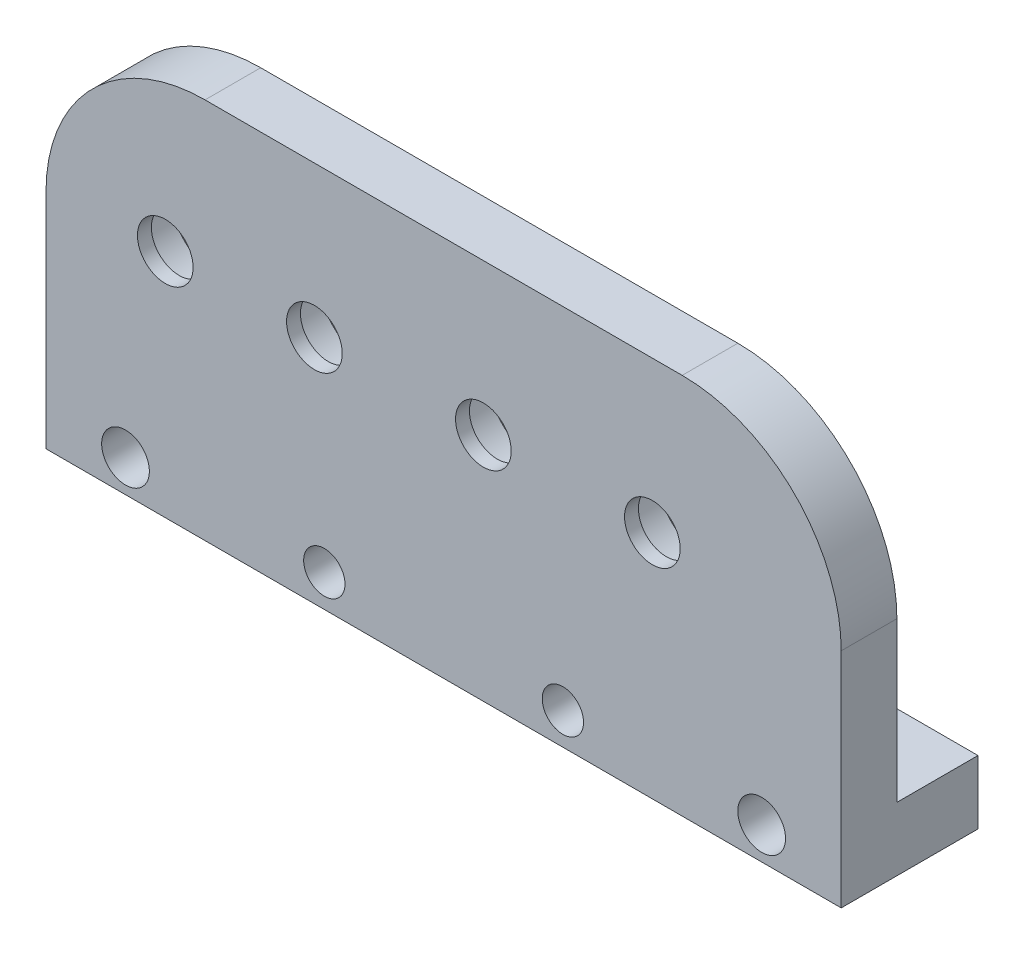
from build123d import *

# Parameters (mm, degrees)
SKETCH1_W           = 100
SKETCH1_H           = 48
BOSS_EXTRUDE1_DEPTH = 7
CUT_EXTRUDE1_REACH  = 113.144
SKETCH2_R           = 3.5
SKETCH3_W           = 100
SKETCH3_H           = 8
BOSS_EXTRUDE2_DEPTH = 10.2
SKETCH4_R           = 6.55
CUT_EXTRUDE2_DEPTH  = 5.25
SKETCH5_R           = 2.6
CUT_EXTRUDE3_DEPTH  = 7
SKETCH7_R           = 1.7
CUT_EXTRUDE4_DEPTH  = 112.391382072
CUT_EXTRUDE5_REACH  = 114.249
SKETCH8_R           = 1.7
SKETCH9_R           = 3
CUT_EXTRUDE6_DEPTH  = 10
FILLET1_R           = 20


with BuildPart() as part:
    # Sketch1 → Boss-Extrude1 (new body)
    with BuildSketch(Plane.XY):
        with Locations((50, 24)):
            Rectangle(SKETCH1_W, SKETCH1_H)
    extrude(amount=BOSS_EXTRUDE1_DEPTH)

    # Sketch2 → Cut-Extrude1 (cut, up to next)
    with BuildSketch(Plane.XY.offset(7), mode=Mode.PRIVATE) as cut_extrude1_sk1:
        with Locations((15, 29)):
            Circle(SKETCH2_R)
    cut_extrude1_tool1 = extrude(cut_extrude1_sk1.sketch, amount=-CUT_EXTRUDE1_REACH, mode=Mode.PRIVATE) & part.part
    # Sketch2 → Cut-Extrude1 (cut, up to next)
    with BuildSketch(Plane.XY.offset(7), mode=Mode.PRIVATE) as cut_extrude1_sk2:
        with Locations((33.75, 29)):
            Circle(SKETCH2_R)
    cut_extrude1_tool2 = extrude(cut_extrude1_sk2.sketch, amount=-CUT_EXTRUDE1_REACH, mode=Mode.PRIVATE) & part.part
    # Sketch2 → Cut-Extrude1 (cut, up to next)
    with BuildSketch(Plane.XY.offset(7), mode=Mode.PRIVATE) as cut_extrude1_sk3:
        with Locations((55, 29)):
            Circle(SKETCH2_R)
    cut_extrude1_tool3 = extrude(cut_extrude1_sk3.sketch, amount=-CUT_EXTRUDE1_REACH, mode=Mode.PRIVATE) & part.part
    # Sketch2 → Cut-Extrude1 (cut, up to next)
    with BuildSketch(Plane.XY.offset(7), mode=Mode.PRIVATE) as cut_extrude1_sk4:
        with Locations((76.25, 29)):
            Circle(SKETCH2_R)
    cut_extrude1_tool4 = extrude(cut_extrude1_sk4.sketch, amount=-CUT_EXTRUDE1_REACH, mode=Mode.PRIVATE) & part.part
    add(cut_extrude1_tool1.solids().sort_by_distance((15, 29, 7))[0], mode=Mode.SUBTRACT)
    add(cut_extrude1_tool2.solids().sort_by_distance((33.75, 29, 7))[0], mode=Mode.SUBTRACT)
    add(cut_extrude1_tool3.solids().sort_by_distance((55, 29, 7))[0], mode=Mode.SUBTRACT)
    add(cut_extrude1_tool4.solids().sort_by_distance((76.25, 29, 7))[0], mode=Mode.SUBTRACT)

    # Sketch3 → Boss-Extrude2 (add)
    with BuildSketch(Plane(origin=(0, 0, 0), x_dir=(-1, 0, 0), z_dir=(0, 0, -1))):
        with Locations((-50, 4)):
            Rectangle(SKETCH3_W, SKETCH3_H)
    extrude(amount=BOSS_EXTRUDE2_DEPTH)

    # Sketch4 → Cut-Extrude2 (cut)
    with BuildSketch(Plane(origin=(0, 0, 0), x_dir=(-1, 0, 0), z_dir=(0, 0, -1))):
        with Locations((-76.25, 29)):
            Circle(SKETCH4_R)
        with Locations((-55, 29)):
            Circle(SKETCH4_R)
        with Locations((-33.75, 29)):
            Circle(SKETCH4_R)
        with Locations((-15, 29)):
            Circle(SKETCH4_R)
    extrude(amount=-CUT_EXTRUDE2_DEPTH, mode=Mode.SUBTRACT)

    # Sketch5 → Cut-Extrude3 (cut)
    with BuildSketch(Plane.XY.offset(7)):
        with Locations((35.000022648, 4.052132501)):
            Circle(SKETCH5_R)
        with Locations((64.999977352, 4)):
            Circle(SKETCH5_R)
    extrude(amount=-CUT_EXTRUDE3_DEPTH, mode=Mode.SUBTRACT)

    # Sketch7 → Cut-Extrude4 (cut, through all)
    with BuildSketch(Plane.XY):
        with Locations((35.000022648, 4.052132501)):
            Circle(SKETCH7_R)
        with Locations((64.999977352, 4)):
            Circle(SKETCH7_R)
    extrude(amount=-CUT_EXTRUDE4_DEPTH, mode=Mode.SUBTRACT)

    # Sketch8 → Cut-Extrude5 (cut, up to next)
    with BuildSketch(Plane.XY.offset(7), mode=Mode.PRIVATE) as cut_extrude5_sk1:
        with Locations((10, 4.052132501)):
            Circle(SKETCH8_R)
    cut_extrude5_tool1 = extrude(cut_extrude5_sk1.sketch, amount=-CUT_EXTRUDE5_REACH, mode=Mode.PRIVATE) & part.part
    # Sketch8 → Cut-Extrude5 (cut, up to next)
    with BuildSketch(Plane.XY.offset(7), mode=Mode.PRIVATE) as cut_extrude5_sk2:
        with Locations((90, 4.052132501)):
            Circle(SKETCH8_R)
    cut_extrude5_tool2 = extrude(cut_extrude5_sk2.sketch, amount=-CUT_EXTRUDE5_REACH, mode=Mode.PRIVATE) & part.part
    add(cut_extrude5_tool1.solids().sort_by_distance((10, 4.052133, 7))[0], mode=Mode.SUBTRACT)
    add(cut_extrude5_tool2.solids().sort_by_distance((90, 4.052133, 7))[0], mode=Mode.SUBTRACT)

    # Sketch9 → Cut-Extrude6 (cut)
    with BuildSketch(Plane.XY.offset(7)):
        with Locations((10, 4.052132501)):
            Circle(SKETCH9_R)
        with Locations((90, 4.052132501)):
            Circle(SKETCH9_R)
    extrude(amount=-CUT_EXTRUDE6_DEPTH, mode=Mode.SUBTRACT)

    # Fillet1
    fillet1_edges = [part.edges().sort_by_distance(p)[0] for p in [
        (0, 48, 3.5),
        (100, 48, 3.5),
    ]]
    fillet(fillet1_edges, radius=FILLET1_R)


solid = part.part
